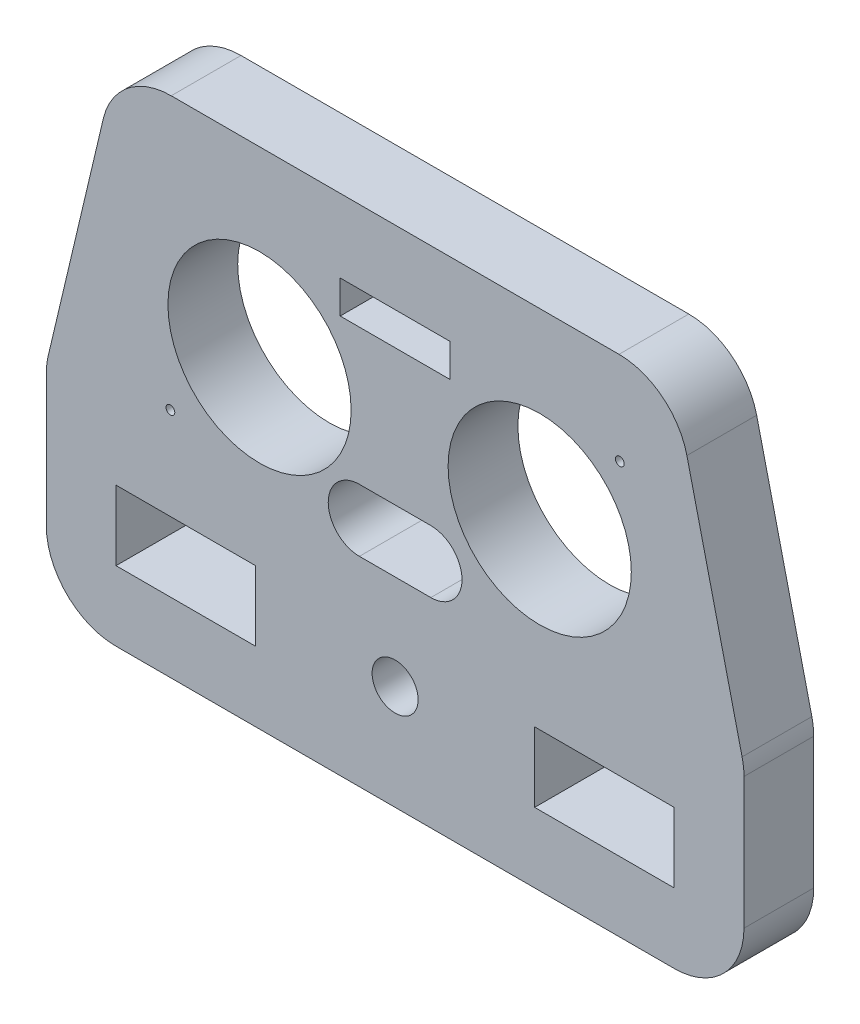
from build123d import *

# Parameters (mm, degrees)
SKETCH1_W           = 63.5
SKETCH1_H           = 19.05
BOSS_EXTRUDE1_DEPTH = 6.35
SKETCH2_R           = 2.0955
SKETCH2_W           = 12.7
SKETCH2_H           = 6.35
CUT_EXTRUDE1_DEPTH  = 6.35
BOSS_EXTRUDE2_DEPTH = 6.35
SKETCH4_W           = 10
SKETCH4_H           = 3
CUT_EXTRUDE2_DEPTH  = 6.35
SKETCH5_R           = 8.336875
CUT_EXTRUDE3_DEPTH  = 6.35
SKETCH6_R           = 0.396875
CUT_EXTRUDE4_DEPTH  = 6.35
FILLET1_R           = 6.35


with BuildPart() as part:
    # Sketch1 → Boss-Extrude1 (new body)
    with BuildSketch(Plane.XY):
        Rectangle(SKETCH1_W, SKETCH1_H)
    extrude(amount=BOSS_EXTRUDE1_DEPTH)

    # Sketch2 → Cut-Extrude1 (cut)
    with BuildSketch(Plane.XY.offset(6.35)):
        Circle(SKETCH2_R)
        with Locations((-19.05, 0)):
            Rectangle(SKETCH2_W, SKETCH2_H)
        with Locations((19.05, 0)):
            Rectangle(SKETCH2_W, SKETCH2_H)
    extrude(amount=-CUT_EXTRUDE1_DEPTH, mode=Mode.SUBTRACT)

    # Sketch3 → Boss-Extrude2 (add)
    with BuildSketch(Plane.XY.offset(6.35)):
        Polygon((-31.75, 9.525), (-25.4, 36.375), (25.4, 36.375), (31.75, 9.525), align=None)
    extrude(amount=-BOSS_EXTRUDE2_DEPTH)

    # Sketch4 → Cut-Extrude2 (cut)
    with BuildSketch(Plane.XY.offset(6.35)):
        with BuildLine():
            Line((-3.25, 8.6375), (3.25, 8.6375))
            ThreePointArc((3.25, 8.6375), (6.0875, 11.475), (3.25, 14.3125))
            Line((3.25, 14.3125), (-3.25, 14.3125))
            ThreePointArc((-3.25, 14.3125), (-6.0875, 11.475), (-3.25, 8.6375))
        make_face()
        with Locations((0, 28.2025)):
            Rectangle(SKETCH4_W, SKETCH4_H)
    extrude(amount=-CUT_EXTRUDE2_DEPTH, mode=Mode.SUBTRACT)

    # Sketch5 → Cut-Extrude3 (cut)
    with BuildSketch(Plane.XY.offset(6.35)):
        with Locations((-12.34, 19.775)):
            Circle(SKETCH5_R)
        with Locations((13.16, 19.775)):
            Circle(SKETCH5_R)
    extrude(amount=-CUT_EXTRUDE3_DEPTH, mode=Mode.SUBTRACT)

    # Sketch6 → Cut-Extrude4 (cut)
    with BuildSketch(Plane(origin=(0, 0, 0), x_dir=(-1, 0, 0), z_dir=(0, 0, -1))):
        with Locations((20.45, 11.575)):
            Circle(SKETCH6_R)
        with Locations((-20.45, 27.975)):
            Circle(SKETCH6_R)
    extrude(amount=-CUT_EXTRUDE4_DEPTH, mode=Mode.SUBTRACT)

    # Fillet1
    fillet1_edges = [part.edges().sort_by_distance(p)[0] for p in [
        (-25.4, 36.375, 3.175),
        (25.4, 36.375, 3.175),
        (31.75, -9.525, 3.175),
        (-31.75, -9.525, 3.175),
        (-31.75, 9.525, 3.175),
        (31.75, 9.525, 3.175),
    ]]
    fillet(fillet1_edges, radius=FILLET1_R)


solid = part.part
